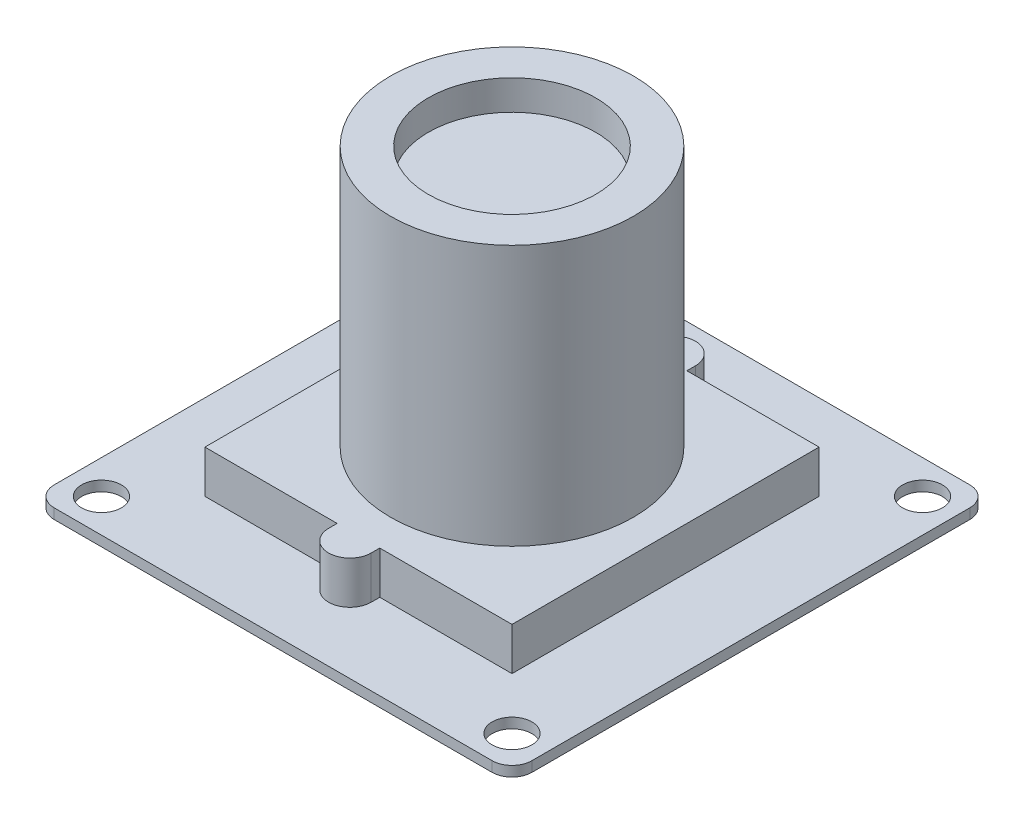
from build123d import *

# Parameters (mm, degrees)
SKETCH1_W           = 32
SKETCH1_H           = 32
BOSS_EXTRUDE1_DEPTH = 0.681
SKETCH2_R           = 1.3335
CUT_EXTRUDE1_DEPTH  = 1
FILLET1_R           = 1.335
SKETCH3_R           = 1.4285
SKETCH3_W           = 20.57
SKETCH3_H           = 20.57
BOSS_EXTRUDE2_DEPTH = 2.857
SKETCH4_R           = 8.1405
BOSS_EXTRUDE3_DEPTH = 17.46
SKETCH6_R           = 5.6075
CUT_EXTRUDE2_DEPTH  = 2


with BuildPart() as part:
    # Sketch1 → Boss-Extrude1 (new body)
    with BuildSketch(Plane(origin=(0, 0, 0), x_dir=(1, 0, 0), z_dir=(0, 1, 0))):
        Rectangle(SKETCH1_W, SKETCH1_H)
    extrude(amount=BOSS_EXTRUDE1_DEPTH)

    # Sketch2 → Cut-Extrude1 (cut)
    with BuildSketch(Plane(origin=(0, 0.681, 0), x_dir=(1, 0, 0), z_dir=(0, 1, 0))):
        with Locations(Location((13.75, 13.75, 0), (0, 0, 270))):
            Circle(SKETCH2_R)
        with Locations(Location((-13.75, 13.75, 0), (0, 0, 270))):
            Circle(SKETCH2_R)
        with Locations(Location((-13.75, -13.75, 0), (0, 0, 270))):
            Circle(SKETCH2_R)
        with Locations(Location((13.75, -13.75, 0), (0, 0, 270))):
            Circle(SKETCH2_R)
    extrude(amount=-CUT_EXTRUDE1_DEPTH, mode=Mode.SUBTRACT)

    # Fillet1
    fillet1_edges = [part.edges().sort_by_distance(p)[0] for p in [
        (16, 0.3405, 16),
        (-16, 0.3405, 16),
        (-16, 0.3405, -16),
        (16, 0.3405, -16),
    ]]
    fillet(fillet1_edges, radius=FILLET1_R)

    # Sketch3 → Boss-Extrude2 (add)
    with BuildSketch(Plane(origin=(0, 0.681, 0), x_dir=(1, 0, 0), z_dir=(0, 1, 0))):
        with Locations((0, -10.857)):
            Circle(SKETCH3_R)
        with Locations((0, 10.857)):
            Circle(SKETCH3_R)
        Rectangle(SKETCH3_W, SKETCH3_H)
        with BuildLine():
            ThreePointArc((1.308979851, -10.285), (0, -9.4285), (-1.308979851, -10.285))
            Line((-1.308979851, -10.285), (1.308979851, -10.285))
        make_face()
        with BuildLine():
            Line((1.308979851, -10.285), (-1.308979851, -10.285))
            ThreePointArc((-1.308979851, -10.285), (-1.398300749, -10.564823227), (-1.4285, -10.857))
            ThreePointArc((-1.4285, -10.857), (0, -12.2855), (1.4285, -10.857))
            ThreePointArc((1.4285, -10.857), (1.398300749, -10.564823227), (1.308979851, -10.285))
        make_face()
        with BuildLine():
            Line((1.4285, -10.285), (1.308979851, -10.285))
            ThreePointArc((1.308979851, -10.285), (1.398300749, -10.564823227), (1.4285, -10.857))
            Line((1.4285, -10.857), (1.4285, -10.285))
        make_face()
        with BuildLine():
            Line((-1.308979851, -10.285), (-1.4285, -10.285))
            Line((-1.4285, -10.285), (-1.4285, -10.857))
            ThreePointArc((-1.4285, -10.857), (-1.398300749, -10.564823227), (-1.308979851, -10.285))
        make_face()
        with BuildLine():
            ThreePointArc((-1.4285, 10.857), (-1.398300749, 10.564823227), (-1.308979851, 10.285))
            Line((-1.308979851, 10.285), (1.308979851, 10.285))
            ThreePointArc((1.308979851, 10.285), (1.398300749, 10.564823227), (1.4285, 10.857))
            ThreePointArc((1.4285, 10.857), (0, 12.2855), (-1.4285, 10.857))
        make_face()
        with BuildLine():
            Line((1.308979851, 10.285), (-1.308979851, 10.285))
            ThreePointArc((-1.308979851, 10.285), (0, 9.4285), (1.308979851, 10.285))
        make_face()
        with BuildLine():
            ThreePointArc((1.4285, 10.857), (1.398300749, 10.564823227), (1.308979851, 10.285))
            Line((1.308979851, 10.285), (1.4285, 10.285))
            Line((1.4285, 10.285), (1.4285, 10.857))
        make_face()
        with BuildLine():
            Line((-1.4285, 10.857), (-1.4285, 10.285))
            Line((-1.4285, 10.285), (-1.308979851, 10.285))
            ThreePointArc((-1.308979851, 10.285), (-1.398300749, 10.564823227), (-1.4285, 10.857))
        make_face()
    extrude(amount=BOSS_EXTRUDE2_DEPTH)

    # Sketch4 → Boss-Extrude3 (add)
    with BuildSketch(Plane(origin=(0, 3.538, 0), x_dir=(1, 0, 0), z_dir=(0, 1, 0))):
        with Locations(Location((0, 0, 0), (0, 0, 270))):
            Circle(SKETCH4_R)
    extrude(amount=BOSS_EXTRUDE3_DEPTH)

    # Sketch6 → Cut-Extrude2 (cut)
    with BuildSketch(Plane(origin=(0, 20.998, 0), x_dir=(1, 0, 0), z_dir=(0, 1, 0))):
        with Locations(Location((0, 0, 0), (0, 0, 270))):
            Circle(SKETCH6_R)
    extrude(amount=-CUT_EXTRUDE2_DEPTH, mode=Mode.SUBTRACT)


solid = part.part
